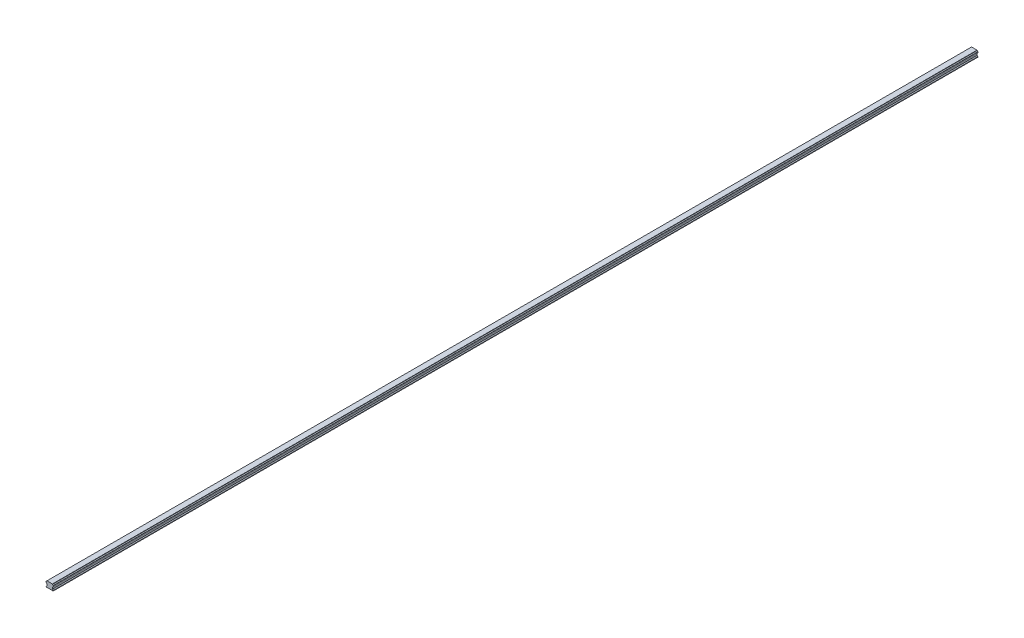
from build123d import *

# Parameters (mm, degrees)
ESTRUSIONE_ESTRUSIONE1_DEPTH = 2900


with BuildPart() as part:
    # Schizzo1 → Estrusione-Estrusione1 (new body)
    with BuildSketch(Plane.XY):
        with BuildLine():
            Line((-10.087089482, -16.415981983), (-7.565622613, -13.894515114))
            Line((-7.565622613, -13.894515114), (-7.565622613, -8.851581376))
            Line((-7.565622613, -8.851581376), (-8.0775657, -8.339638289))
            ThreePointArc((-8.0775657, -8.339638289), (-8.808436534, -6.752953221), (-10.395121602, -6.022082387))
            Line((-10.395121602, -6.022082387), (-10.591382856, -5.825821133))
            Line((-10.591382856, -5.825821133), (-10.591382856, -2.800060891))
            Line((-10.591382856, -2.800060891), (-10.395121602, -2.603799637))
            ThreePointArc((-10.395121602, -2.603799637), (-8.808436534, -1.872928803), (-8.0775657, -0.286243735))
            Line((-8.0775657, -0.286243735), (-7.565622613, 0.225699352))
            Line((-7.565622613, 0.225699352), (9.580352097, 0.225699352))
            Line((9.580352097, 0.225699352), (10.092295184, -0.286243735))
            ThreePointArc((10.092295184, -0.286243735), (10.823166018, -1.872928803), (12.409851086, -2.603799637))
            Line((12.409851086, -2.603799637), (12.606112339, -2.800060891))
            Line((12.606112339, -2.800060891), (12.606112339, -5.825821133))
            Line((12.606112339, -5.825821133), (12.409851086, -6.022082387))
            ThreePointArc((12.409851086, -6.022082387), (10.823166018, -6.752953221), (10.092295184, -8.339638289))
            Line((10.092295184, -8.339638289), (9.580352097, -8.851581376))
            Line((9.580352097, -8.851581376), (9.580352097, -13.894515114))
            Line((9.580352097, -13.894515114), (12.101818966, -16.415981983))
            Line((12.101818966, -16.415981983), (12.101818966, -17.774300648))
            Line((12.101818966, -17.774300648), (-10.087089482, -17.774300648))
            Line((-10.087089482, -17.774300648), (-10.087089482, -16.415981983))
        make_face()
    extrude(amount=ESTRUSIONE_ESTRUSIONE1_DEPTH)


solid = part.part
